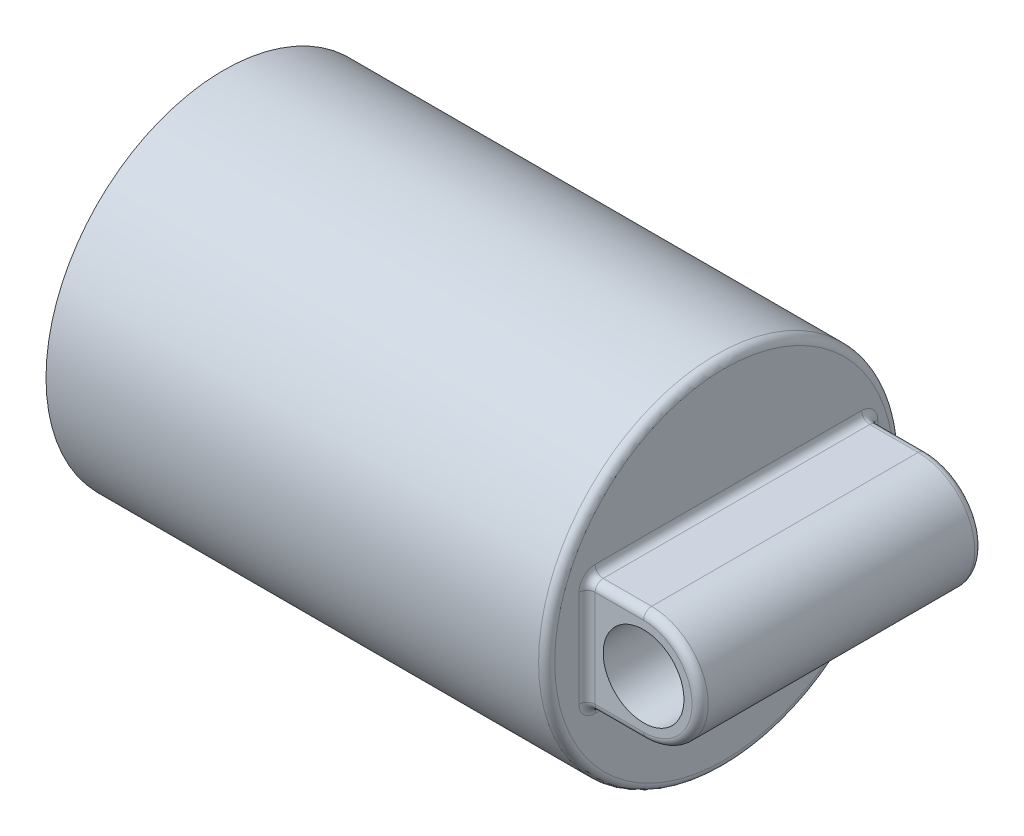
from build123d import *

# Parameters (mm, degrees)
SKETCH3_R           = 5
BOSS_EXTRUDE2_DEPTH = 35
FILLET2_R           = 1
FILLET3_R           = 1


with BuildPart() as part:
    # Sketch1 → Revolve1 (revolve)
    with BuildSketch(Plane.XY, mode=Mode.PRIVATE) as revolve1_sk:
        Polygon((2, 22), (2, 0), (0, 0), (0, 20), (-60, 20), (-60, 22), align=None)
    revolve(revolve1_sk.sketch.rotate(Axis((-25.911369332, 0, 0), (1, 0, 0)), 90), axis=Axis((-25.911369332, 0, 0), (1, 0, 0)))

    # Sketch3 → Boss-Extrude2 (add)
    with BuildSketch(Plane.XY.offset(17)):
        with BuildLine():
            Line((9, 7), (2, 7))
            Line((2, 7), (2, -7))
            Line((2, -7), (9, -7))
            ThreePointArc((9, -7), (16, 0), (9, 7))
        make_face()
        with Locations((9, 0)):
            Circle(SKETCH3_R, mode=Mode.SUBTRACT)
    extrude(amount=-BOSS_EXTRUDE2_DEPTH)

    # Fillet2
    fillet2_edges = [part.edges().sort_by_distance(p)[0] for p in [
        (2, 0, -22),
    ]]
    fillet(fillet2_edges, radius=FILLET2_R)

    # Fillet3
    fillet3_edges = [part.edges().sort_by_distance(p)[0] for p in [
        (16, 0, -18),
        (5.5, -7, -18),
        (2, 0, -18),
        (2, -7, -0.5),
        (5.5, 7, -18),
        (2, 7, -0.5),
        (16, 0, 17),
        (5.5, 7, 17),
        (2, 0, 17),
        (5.5, -7, 17),
    ]]
    fillet(fillet3_edges, radius=FILLET3_R)


solid = part.part
